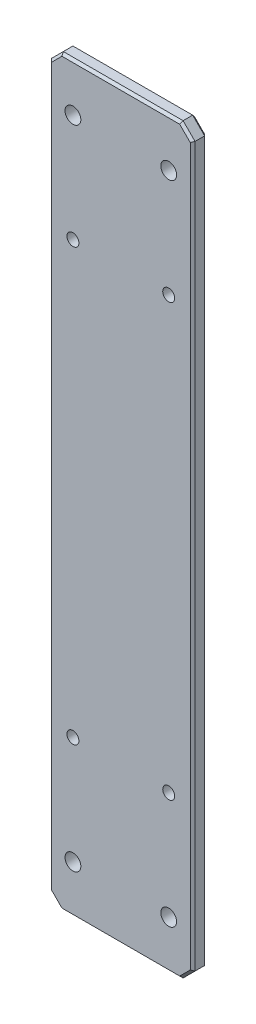
from build123d import *

# Parameters (mm, degrees)
SKETCH_1_W             = 60
SKETCH_1_H             = 310
EXTRUDE_1_DEPTH        = 6
SKETCH_2_R             = 3.3
CUT_EXTRUDE_1_DEPTH    = 158.990506044
CHAMFER_2_SIZE         = 5
CHAMFER_1_SIZE         = 1
HOLE_WIZARD_M6_1_D     = 5
HOLE_WIZARD_M6_1_DEPTH = 19.75
HOLE_WIZARD_M6_1_TIP   = 1.502151548


with BuildPart() as part:
    # 草图1 → 凸台-拉伸1 (new body)
    with BuildSketch(Plane.XY):
        Rectangle(SKETCH_1_W, SKETCH_1_H)
    extrude(amount=EXTRUDE_1_DEPTH)

    # 草图2 → 切除-拉伸1 (cut, through all)
    with BuildSketch(Plane.XY.offset(6)):
        with Locations((-20, 135)):
            Circle(SKETCH_2_R)
        with Locations((20, 135)):
            Circle(SKETCH_2_R)
        with Locations((-20, -135)):
            Circle(SKETCH_2_R)
        with Locations((20, -135)):
            Circle(SKETCH_2_R)
    extrude(amount=-CUT_EXTRUDE_1_DEPTH, mode=Mode.SUBTRACT)

    # 倒角2
    chamfer_2_edges = [part.edges().sort_by_distance(p)[0] for p in [
        (30, -155, 3),
        (-30, -155, 3),
        (-30, 155, 3),
        (30, 155, 3),
    ]]
    chamfer(chamfer_2_edges, length=CHAMFER_2_SIZE)

    # 倒角1
    chamfer_1_edges = [part.edges().sort_by_distance(p)[0] for p in [
        (0, -155, 0),
        (0, -155, 6),
        (30, 0, 0),
        (-30, 0, 0),
        (0, 155, 0),
        (27.5, 152.5, 0),
        (-27.5, 152.5, 0),
        (27.5, -152.5, 0),
        (-27.5, -152.5, 0),
        (-30, 0, 6),
        (30, 0, 6),
        (0, 155, 6),
        (27.5, 152.5, 6),
        (-27.5, 152.5, 6),
        (27.5, -152.5, 6),
        (-27.5, -152.5, 6),
    ]]
    chamfer(chamfer_1_edges, length=CHAMFER_1_SIZE)

    # M6 螺纹孔1
    with Locations(Plane(origin=(0, 0, 0), x_dir=(-1, 0, 0), z_dir=(0, 0, -1))):
        with Locations((-20, 89.999999889), (20, 89.999999889), (20, -90.000000111), (-20, -90.000000111)):
            Hole(HOLE_WIZARD_M6_1_D / 2, depth=HOLE_WIZARD_M6_1_DEPTH)
            with Locations((0, 0, -(HOLE_WIZARD_M6_1_DEPTH + HOLE_WIZARD_M6_1_TIP / 2))):  # 118° drill point
                Cone(0, HOLE_WIZARD_M6_1_D / 2, HOLE_WIZARD_M6_1_TIP, mode=Mode.SUBTRACT)


solid = part.part
